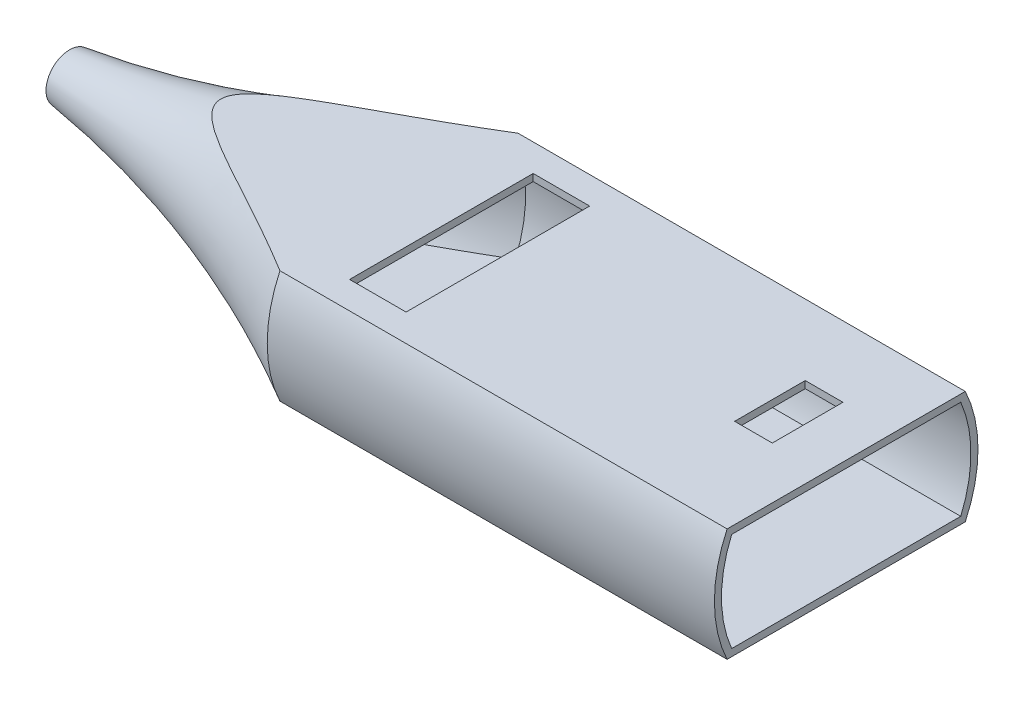
from build123d import *

# Parameters (mm, degrees)
CORTE_EXTRUS_O2_DEPTH = 170.685002284
CASCA2_T              = -1.5
ESBO_O9_R             = 3
CORTE_EXTRUS_O3_DEPTH = 168.788557539
ESBO_O10_W            = 12
ESBO_O10_H            = 39
CORTE_EXTRUS_O4_DEPTH = 1.5
ESBO_O11_W            = 8
ESBO_O11_H            = 15
CORTE_EXTRUS_O5_DEPTH = 1.5


with BuildPart() as part:
    # Esboço7 → Revolução1 (revolve)
    with BuildSketch(Plane.XY, mode=Mode.PRIVATE) as revolu_o1_sk:
        with BuildLine():
            Line((-58.672933336, 0), (-58.672933336, 5))
            ThreePointArc((-58.672933336, 5), (-22.604617679, 13.248604524), (11.327066664, 28))
            Line((11.327066664, 28), (106.327066664, 28))
            Line((106.327066664, 28), (106.327066664, 0))
            Line((106.327066664, 0), (-58.672933336, 0))
        make_face()
    revolve(revolu_o1_sk.sketch.rotate(Axis((-70.454996685, 0, 0), (1, 0, 0)), 90), axis=Axis((-70.454996685, 0, 0), (1, 0, 0)))

    # Esboço8 → Corte-extrusão2 (cut, through all)
    with BuildSketch(Plane(origin=(106.327066664, 0, 0), x_dir=(0, 0, -1), z_dir=(1, 0, 0))):
        with BuildLine():
            Line((-25.298221281, 12), (25.298221281, 12))
            ThreePointArc((25.298221281, 12), (0, 28), (-25.298221281, 12))
        make_face()
        with BuildLine():
            Line((-25.298221281, -12), (25.298221281, -12))
            ThreePointArc((25.298221281, -12), (0, -28), (-25.298221281, -12))
        make_face()
    extrude(amount=-CORTE_EXTRUS_O2_DEPTH, mode=Mode.SUBTRACT)

    # Casca2
    casca2_openings = [part.faces().sort_by_distance(p)[0] for p in [
        (106.327066664, 0, 0),
    ]]
    offset(amount=CASCA2_T, openings=casca2_openings)

    # Esboço9 → Corte-extrusão3 (cut, through all)
    with BuildSketch(Plane.ZY.offset(58.672933336)):
        Circle(ESBO_O9_R)
    extrude(amount=-CORTE_EXTRUS_O3_DEPTH, mode=Mode.SUBTRACT)

    # Esboço10 → Corte-extrusão4 (cut)
    with BuildSketch(Plane(origin=(0, 12, 0), x_dir=(1, 0, 0), z_dir=(0, 1, 0))):
        with Locations((26.327066664, 0)):
            Rectangle(ESBO_O10_W, ESBO_O10_H)
    extrude(amount=-CORTE_EXTRUS_O4_DEPTH, mode=Mode.SUBTRACT)

    # Esboço11 → Corte-extrusão5 (cut)
    with BuildSketch(Plane(origin=(0, 12, 0), x_dir=(1, 0, 0), z_dir=(0, 1, 0))):
        with Locations((91.327066664, 2.798221281)):
            Rectangle(ESBO_O11_W, ESBO_O11_H)
    extrude(amount=-CORTE_EXTRUS_O5_DEPTH, mode=Mode.SUBTRACT)


solid = part.part
